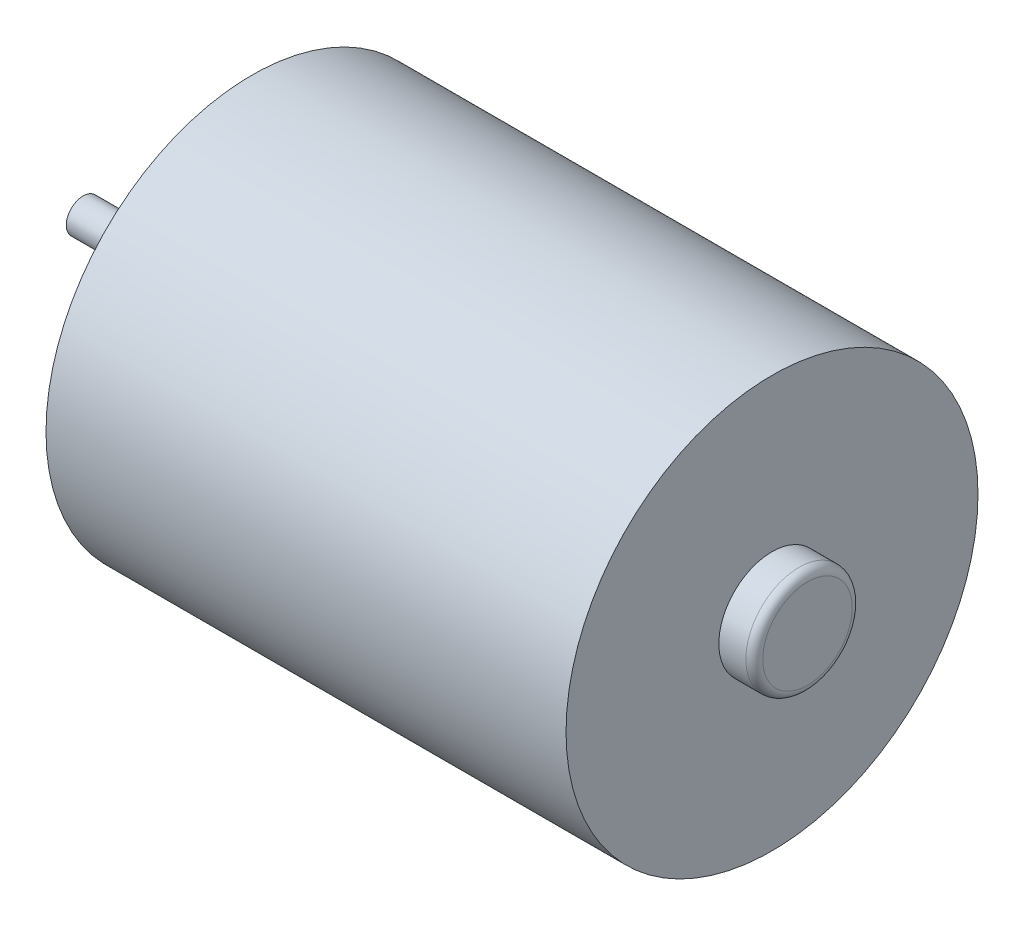
from build123d import *

# Parameters (mm, degrees)
SKETCH_1_R          = 12.2
EXTRUDE_1_DEPTH     = 30.8
SKETCH_3_R          = 3.15
EXTRUDE_2_DEPTH     = 2.1
FILLET_1_R          = 0.5
SKETCH_4_R          = 3.225
EXTRUDE_3_DEPTH     = 1.7
SKETCH_6_R          = 1
EXTRUDE_4_DEPTH     = 10
SKETCH_7_R          = 1.1
CUT_EXTRUDE_2_DEPTH = 3


with BuildPart() as part:
    # 草图1 → 凸台-拉伸1 (new body)
    with BuildSketch(Plane(origin=(0, 0, 0), x_dir=(0, 0, -1), z_dir=(1, 0, 0))):
        with Locations(Location((0, 0, 0), (0, 0, 180))):
            Circle(SKETCH_1_R)
    extrude(amount=EXTRUDE_1_DEPTH)

    # 草图3 → 凸台-拉伸2 (add)
    with BuildSketch(Plane(origin=(30.8, 0, 0), x_dir=(0, 0, -1), z_dir=(1, 0, 0))):
        Circle(SKETCH_3_R)
    extrude(amount=EXTRUDE_2_DEPTH)

    # 圆角1
    fillet_1_edges = [part.edges().sort_by_distance(p)[0] for p in [
        (32.9, 0, 3.15),
    ]]
    fillet(fillet_1_edges, radius=FILLET_1_R)

    # 草图4 → 凸台-拉伸3 (add)
    with BuildSketch(Plane.ZY):
        Circle(SKETCH_4_R)
    extrude(amount=EXTRUDE_3_DEPTH)

    # 草图6 → 凸台-拉伸4 (add)
    with BuildSketch(Plane.ZY):
        Circle(SKETCH_6_R)
    extrude(amount=EXTRUDE_4_DEPTH)

    # 草图7 → 切除-拉伸2 (cut)
    with BuildSketch(Plane.ZY):
        with Locations((8.5, 0)):
            Circle(SKETCH_7_R)
        with Locations((-8.5, 0)):
            Circle(SKETCH_7_R)
    extrude(amount=-CUT_EXTRUDE_2_DEPTH, mode=Mode.SUBTRACT)


solid = part.part
